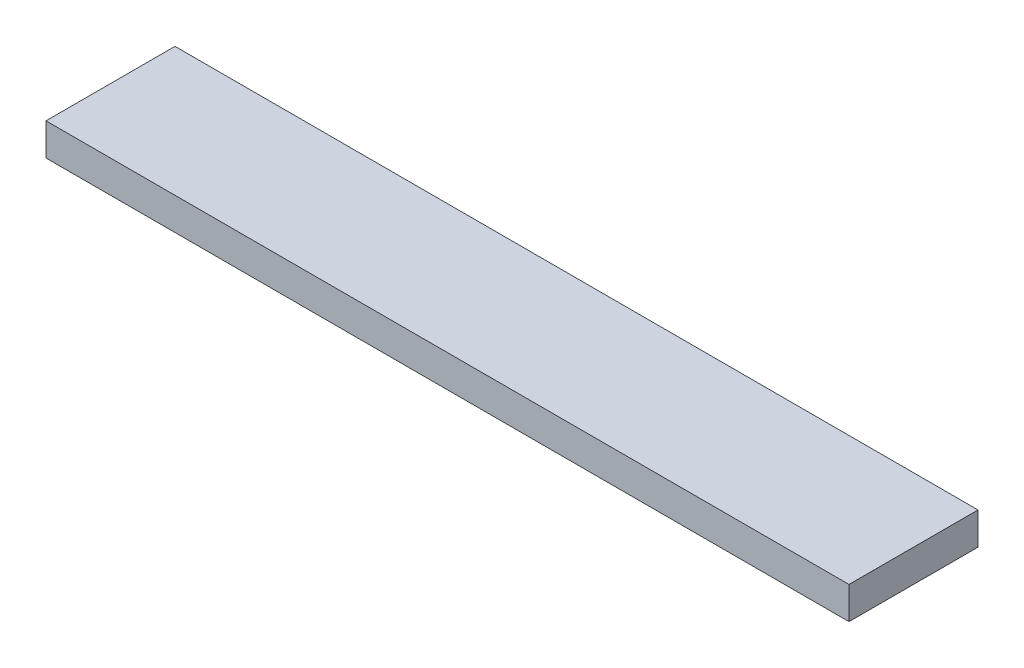
from build123d import *

# Parameters (mm, degrees)
SKETCH_1_W      = 124.5
SKETCH_1_H      = 20
EXTRUDE_1_DEPTH = 5


with BuildPart() as part:
    # 스케치1 → 보스-돌출1 (new body)
    with BuildSketch(Plane(origin=(0, 0, 0), x_dir=(1, 0, 0), z_dir=(0, 1, 0))):
        with Locations((62.25, 10)):
            Rectangle(SKETCH_1_W, SKETCH_1_H)
    extrude(amount=EXTRUDE_1_DEPTH)


solid = part.part
